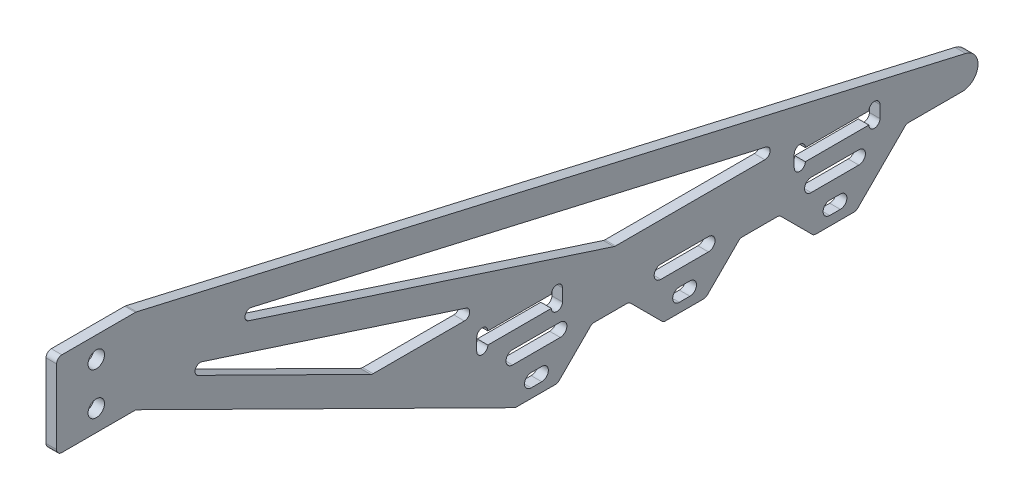
from build123d import *

# Parameters (mm, degrees)
SKETCH_1_R      = 1.55
EXTRUDE_1_DEPTH = 2
FILLET_1_R      = 1
FILLET_2_R      = 3


with BuildPart() as part:
    # 草图1 → 凸台-拉伸1 (new body)
    with BuildSketch(Plane(origin=(0, 0, 0), x_dir=(0, 0, -1), z_dir=(1, 0, 0))):
        Polygon((7.5, 12), (-7.5, 12), (-7.5, -4), (7.5, -4), (79.182692308, -39.5), (87.182692308, -39.5), (93.682692308, -33), (100.682692308, -33), (107.182692308, -39.5), (115.182692308, -39.5), (121.682692308, -33), (129.1, -33), (135.6, -39.5), (143.6, -39.5), (153.1, -30), (190.043283582, -30), align=None)
        with BuildLine():
            Line((78.682692308, -29.75), (87.682692308, -29.75))
            ThreePointArc((87.682692308, -29.75), (88.932692308, -31), (87.682692308, -32.25))
            Line((87.682692308, -32.25), (78.682692308, -32.25))
            ThreePointArc((78.682692308, -32.25), (77.432692308, -31), (78.682692308, -29.75))
        make_face(mode=Mode.SUBTRACT)
        with BuildLine():
            Line((106.682692308, -29.75), (115.682692308, -29.75))
            ThreePointArc((115.682692308, -29.75), (116.932692308, -31), (115.682692308, -32.25))
            Line((115.682692308, -32.25), (106.682692308, -32.25))
            ThreePointArc((106.682692308, -32.25), (105.432692308, -31), (106.682692308, -29.75))
        make_face(mode=Mode.SUBTRACT)
        with BuildLine():
            Line((135.1, -29.75), (144.1, -29.75))
            ThreePointArc((144.1, -29.75), (145.35, -31), (144.1, -32.25))
            Line((144.1, -32.25), (135.1, -32.25))
            ThreePointArc((135.1, -32.25), (133.85, -31), (135.1, -29.75))
        make_face(mode=Mode.SUBTRACT)
        with BuildLine():
            Line((86, -26.65), (74, -26.65))
            ThreePointArc((74, -26.65), (72.95, -27.7), (71.9, -26.65))
            Line((71.9, -26.65), (71.9, -24.35))
            ThreePointArc((71.9, -24.35), (72.95, -23.3), (74, -24.35))
            Line((74, -24.35), (86, -24.35))
            ThreePointArc((86, -24.35), (87.05, -23.3), (88.1, -24.35))
            Line((88.1, -24.35), (88.1, -26.65))
            ThreePointArc((88.1, -26.65), (87.05, -27.7), (86, -26.65))
        make_face(mode=Mode.SUBTRACT)
        with BuildLine():
            Line((146, -26.65), (134, -26.65))
            ThreePointArc((134, -26.65), (132.95, -27.7), (131.9, -26.65))
            Line((131.9, -26.65), (131.9, -24.35))
            ThreePointArc((131.9, -24.35), (132.95, -23.3), (134, -24.35))
            Line((134, -24.35), (146, -24.35))
            ThreePointArc((146, -24.35), (147.05, -23.3), (148.1, -24.35))
            Line((148.1, -24.35), (148.1, -26.65))
            ThreePointArc((148.1, -26.65), (147.05, -27.7), (146, -26.65))
        make_face(mode=Mode.SUBTRACT)
        Polygon((52.083732258, -20.5), (7, 1.827181689), (75.890858402, -20.5), align=None, mode=Mode.SUBTRACT)
        Polygon((97.974573659, -22.5), (7, 6.984403045), (135.147136815, -22.5), align=None, mode=Mode.SUBTRACT)
        Circle(SKETCH_1_R, mode=Mode.SUBTRACT)
        with Locations((0, 8)):
            Circle(SKETCH_1_R, mode=Mode.SUBTRACT)
        with BuildLine():
            Line((138.6, -35.25), (140.6, -35.25))
            ThreePointArc((140.6, -35.25), (141.85, -36.5), (140.6, -37.75))
            Line((140.6, -37.75), (138.6, -37.75))
            ThreePointArc((138.6, -37.75), (137.35, -36.5), (138.6, -35.25))
        make_face(mode=Mode.SUBTRACT)
        with BuildLine():
            ThreePointArc((82.182692308, -37.75), (80.932692308, -36.5), (82.182692308, -35.25))
            Line((82.182692308, -35.25), (84.182692308, -35.25))
            ThreePointArc((84.182692308, -35.25), (85.432692308, -36.5), (84.182692308, -37.75))
            Line((84.182692308, -37.75), (82.182692308, -37.75))
        make_face(mode=Mode.SUBTRACT)
        with BuildLine():
            ThreePointArc((110.182692308, -37.75), (108.932692308, -36.5), (110.182692308, -35.25))
            Line((110.182692308, -35.25), (112.182692308, -35.25))
            ThreePointArc((112.182692308, -35.25), (113.432692308, -36.5), (112.182692308, -37.75))
            Line((112.182692308, -37.75), (110.182692308, -37.75))
        make_face(mode=Mode.SUBTRACT)
    extrude(amount=EXTRUDE_1_DEPTH)

    # 圆角1
    fillet_1_edges = [part.edges().sort_by_distance(p)[0] for p in [
        (1, -33, -121.682692308),
        (1, -39.5, -115.182692308),
        (1, -39.5, -107.182692308),
        (1, -33, -100.682692308),
        (1, -33, -93.682692308),
        (1, -39.5, -87.182692308),
        (1, -39.5, -79.182692308),
        (1, -4, -7.5),
        (1, -4, 7.5),
        (1, 12, 7.5),
        (1, 12, -7.5),
        (1, -30, -153.1),
        (1, -39.5, -143.6),
        (1, -39.5, -135.6),
        (1, -33, -129.1),
        (1, 6.984403045, -7),
        (1, -22.5, -97.974573659),
        (1, -22.5, -135.147136815),
        (1, 1.827181689, -7),
        (1, -20.5, -52.083732258),
        (1, -20.5, -75.890858402),
    ]]
    fillet(fillet_1_edges, radius=FILLET_1_R)

    # 圆角2
    fillet_2_edges = [part.edges().sort_by_distance(p)[0] for p in [
        (1, -30, -190.043283582),
    ]]
    fillet(fillet_2_edges, radius=FILLET_2_R)


solid = part.part
